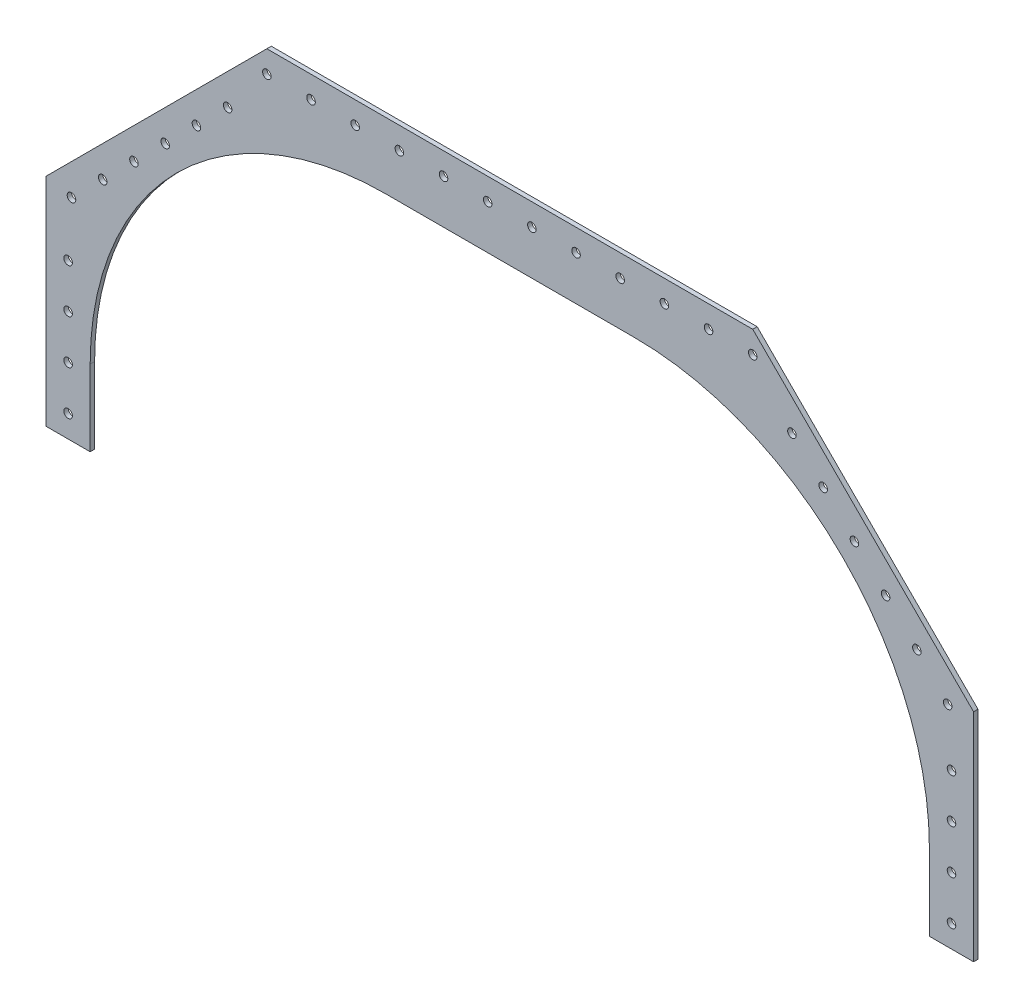
from build123d import *

# Parameters (mm, degrees)
BOSS_EXTRUDE1_DEPTH   = 2.54
F_8_CLEARANCE_HOLE1_D = 4.9149


with BuildPart() as part:
    # Sketch1 → Boss-Extrude1 (new body)
    with BuildSketch(Plane.XY):
        with BuildLine():
            Line((266.7, 0), (241.3, 0))
            Line((241.3, 0), (241.3, 43.70119491))
            ThreePointArc((241.3, 43.70119491), (191.589487758, 163.712987758), (71.57769491, 213.4235))
            Line((71.57769491, 213.4235), (-71.57769491, 213.4235))
            ThreePointArc((-71.57769491, 213.4235), (-191.589487758, 163.712987758), (-241.3, 43.70119491))
            Line((-241.3, 43.70119491), (-241.3, 0))
            Line((-241.3, 0), (-266.7, 0))
            Line((-266.7, 0), (-266.7, 124.5235))
            Line((-266.7, 124.5235), (-139.7, 251.5235))
            Line((-139.7, 251.5235), (139.7, 251.5235))
            Line((139.7, 251.5235), (266.7, 124.5235))
            Line((266.7, 124.5235), (266.7, 0))
        make_face()
    extrude(amount=BOSS_EXTRUDE1_DEPTH)

    # #8 Clearance Hole1 (through all)
    with Locations(Plane(origin=(0, 0, 0), x_dir=(-1, 0, 0), z_dir=(0, 0, -1))):
        with Locations((-254, 12.7635), (-254, 38.1635), (-254, 63.5635), (-254, 88.9635), (-251.804819447, 120.777889402), (-234.083674396, 139.179313362), (-216.123162153, 157.139825604), (-198.162649911, 175.100337847), (-180.202137669, 193.060850089), (-162.241625427, 211.021362331), (-114.3, 238.8235), (-88.9, 238.8235), (-63.5, 238.8235), (-38.1, 238.8235), (-12.7, 238.8235), (12.7, 238.8235), (38.1, 238.8235), (63.5, 238.8235), (88.9, 238.8235), (114.3, 238.8235), (139.7, 238.8235), (162.241625427, 211.021362331), (180.202137669, 193.060850089), (198.162649911, 175.100337847), (216.123162153, 157.139825604), (234.083674396, 139.179313362), (252.044186638, 121.21880112), (254, 88.9635), (254, 63.5635), (254, 38.1635), (254, 12.7635), (-139.7, 238.8235)):
            Hole(F_8_CLEARANCE_HOLE1_D / 2)


solid = part.part
